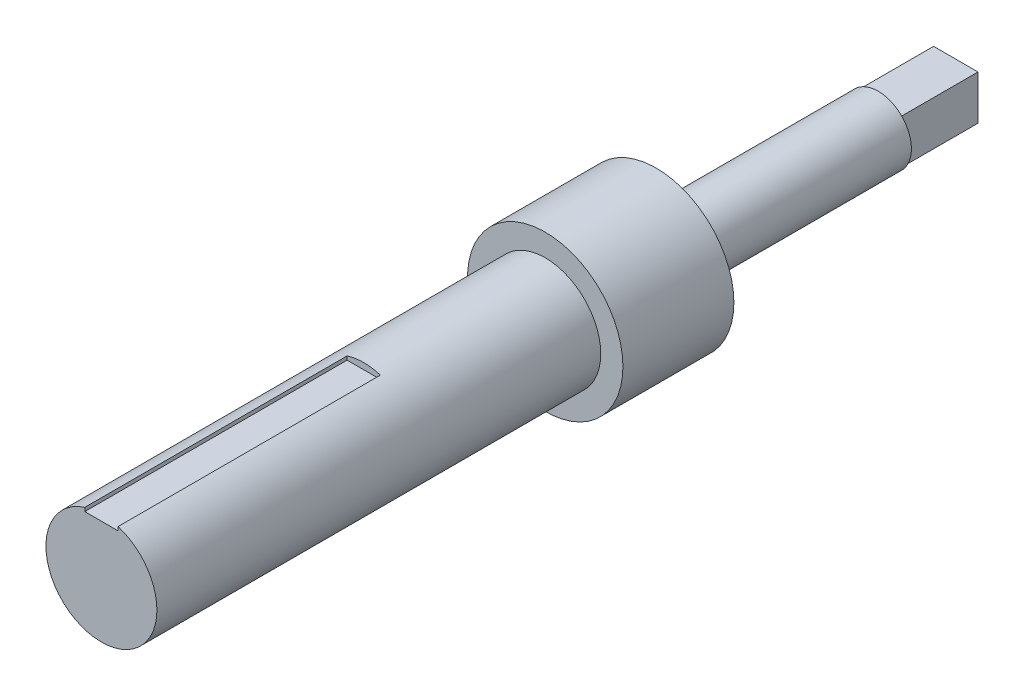
from build123d import *

# Parameters (mm, degrees)
SKETCH_1_R          = 3.5
EXTRUDE_1_DEPTH     = 25
SKETCH_2_R          = 1.5
EXTRUDE_2_DEPTH     = 10
SKETCH_3_W          = 2
SKETCH_3_H          = 2
EXTRUDE_3_DEPTH     = 3.5
SKETCH_4_OUTSIDE_W  = 16.95
SKETCH_4_OUTSIDE_H  = 16.95
SKETCH_4_OUTSIDE_R  = 2.5
CUT_EXTRUDE_1_DEPTH = 20
SKETCH_5_W          = 1.5
SKETCH_5_H          = 0.547111854
CUT_EXTRUDE_2_DEPTH = 11.820119966


with BuildPart() as part:
    # 草图1 → 拉伸1 (new body)
    with BuildSketch(Plane.XY):
        Circle(SKETCH_1_R)
    extrude(amount=EXTRUDE_1_DEPTH)

    # 草图2 → 拉伸2 (add)
    with BuildSketch(Plane(origin=(0, 0, 0), x_dir=(-1, 0, 0), z_dir=(0, 0, -1))):
        with Locations(Location((0, 0, 0), (0, 0, 180))):
            Circle(SKETCH_2_R)
    extrude(amount=EXTRUDE_2_DEPTH)

    # 草图3 → 拉伸3 (add)
    with BuildSketch(Plane(origin=(0, 0, -10), x_dir=(-1, 0, 0), z_dir=(0, 0, -1))):
        Rectangle(SKETCH_3_W, SKETCH_3_H)
    extrude(amount=EXTRUDE_3_DEPTH)

    # 草图4 outside → 切除-拉伸1 (cut)
    with BuildSketch(Plane.XY.offset(25)):
        Rectangle(SKETCH_4_OUTSIDE_W, SKETCH_4_OUTSIDE_H)
        Circle(SKETCH_4_OUTSIDE_R, mode=Mode.SUBTRACT)
    extrude(amount=-CUT_EXTRUDE_1_DEPTH, mode=Mode.SUBTRACT)

    # 草图5 → 切除-拉伸2 (cut)
    with BuildSketch(Plane.XY.offset(25)):
        with Locations((0, 2.491129658)):
            Rectangle(SKETCH_5_W, SKETCH_5_H)
    extrude(amount=-CUT_EXTRUDE_2_DEPTH, mode=Mode.SUBTRACT)


solid = part.part
